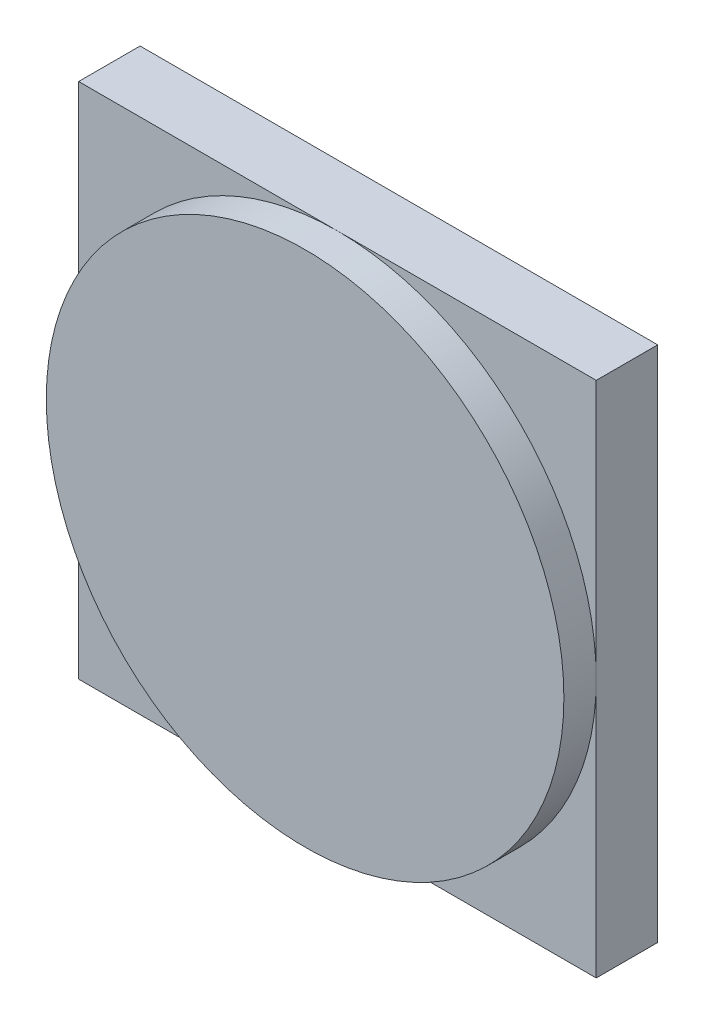
from build123d import *

# Parameters (mm, degrees)
SKETCH1_R           = 40
BOSS_EXTRUDE1_DEPTH = 5
SKETCH2_W           = 80
SKETCH2_H           = 80
BOSS_EXTRUDE2_DEPTH = 9.5


with BuildPart() as part:
    # Sketch1 → Boss-Extrude1 (new body)
    with BuildSketch(Plane(origin=(0, 0, 0), x_dir=(0, 1, 0), z_dir=(0, 0, 1))):
        with Locations(Location((0, 0, 0), (0, 0, 270))):
            Circle(SKETCH1_R)
    extrude(amount=BOSS_EXTRUDE1_DEPTH)

    # Sketch2 → Boss-Extrude2 (add)
    with BuildSketch(Plane(origin=(0, 0, 0), x_dir=(1, 0, 0), z_dir=(0, 0, -1))):
        Rectangle(SKETCH2_W, SKETCH2_H)
    extrude(amount=BOSS_EXTRUDE2_DEPTH)


solid = part.part
